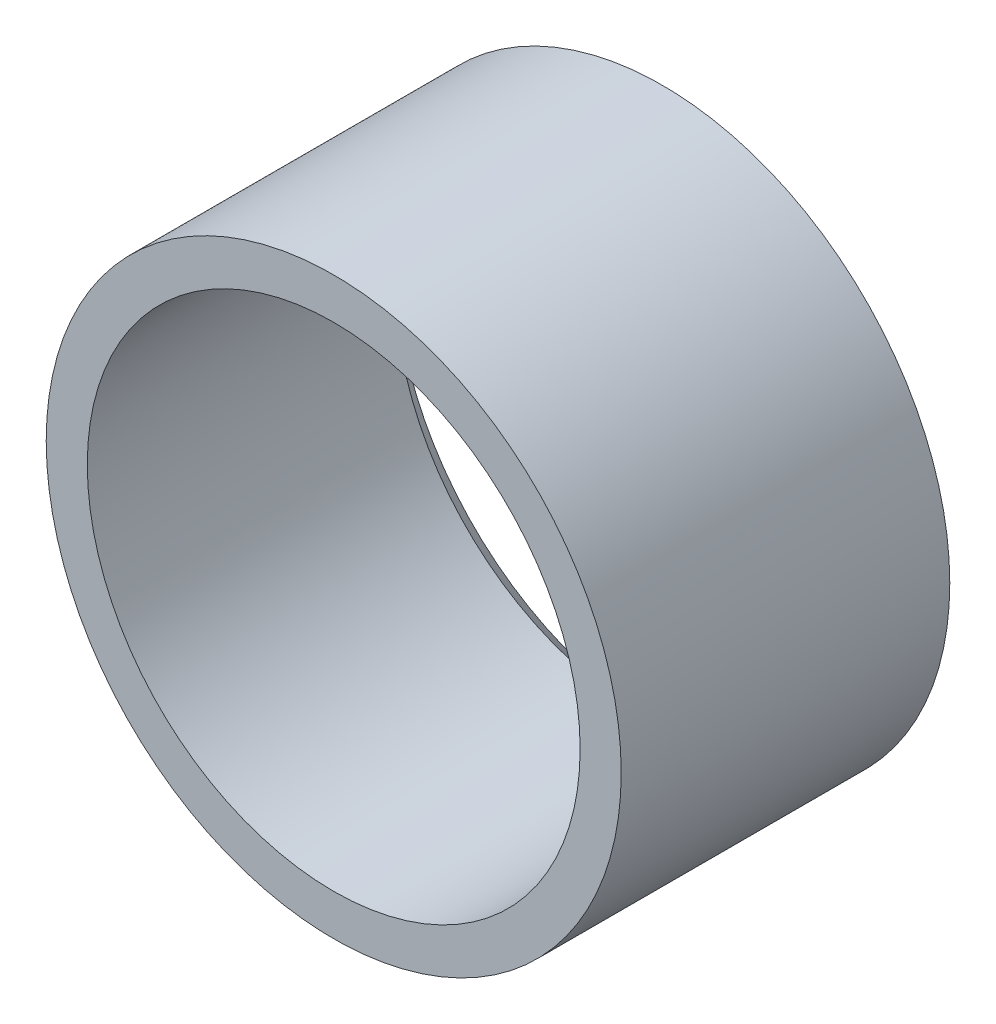
from build123d import *

# Parameters (mm, degrees)
SKETCH_1_R      = 7
SKETCH_1_R_2    = 6
EXTRUDE_1_DEPTH = 8
CHAMFER_1_SIZE  = 0.5


with BuildPart() as part:
    # 草图1 → 凸台-拉伸1 (new body)
    with BuildSketch(Plane.XY):
        Circle(SKETCH_1_R)
        Circle(SKETCH_1_R_2, mode=Mode.SUBTRACT)
    extrude(amount=EXTRUDE_1_DEPTH)

    # 倒角1
    chamfer_1_edges = [part.edges().sort_by_distance(p)[0] for p in [
        (-6, 0, 0),
    ]]
    chamfer(chamfer_1_edges, length=CHAMFER_1_SIZE)


solid = part.part
